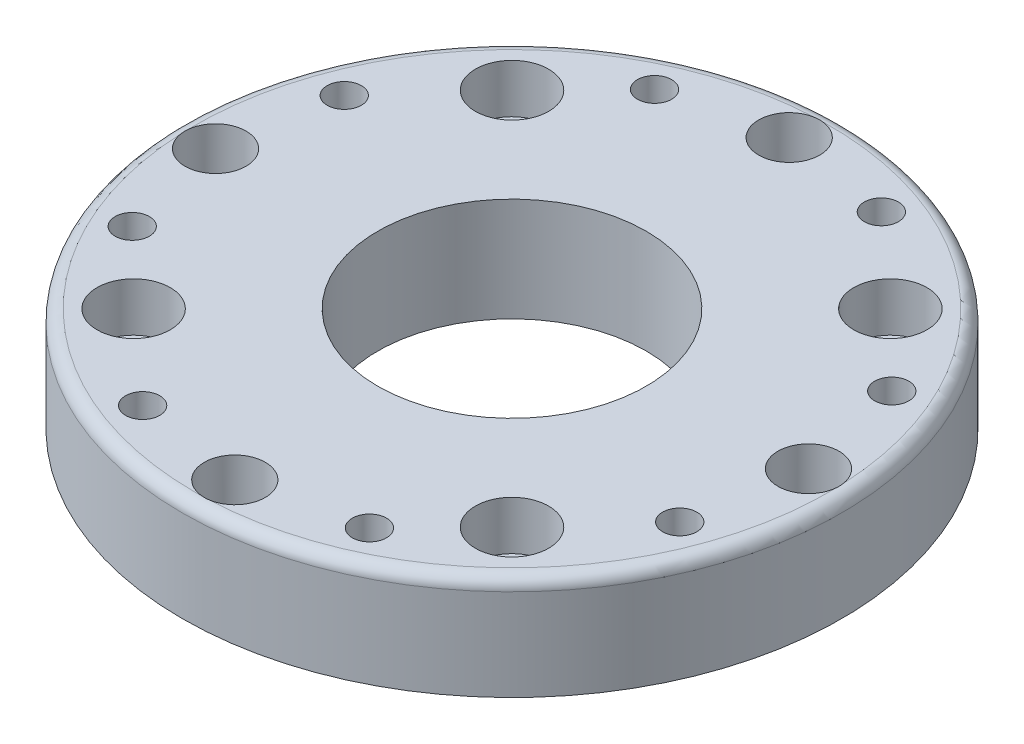
from build123d import *

# Parameters (mm, degrees)
SKETCH2_R                      = 27
BOSS_EXTRUDE1_DEPTH            = 8.5
SKETCH3_R                      = 1.6
NEMA_MOUNTS_HOLES_M3_DEPTH     = 8.5
SKETCH3_4_R                    = 3
NEMA_MOUNT_HOLES_CAP_6MM_DEPTH = 4
SKETCH5_R                      = 1.4
REDUCER_HOLES_M2_5_DEPTH       = 8.5
REDUCER_NUTS_M2_5_DEPTH        = 4
SKETCH9_R                      = 11
SHAFT_SKIRT_22MM_DEPTH         = 8.5
FILLET1_R                      = 1
CUT_EXTRUDE1_START             = -8.5
SKETCH10_R                     = 2.5
CUT_EXTRUDE1_DEPTH             = 5
FILLET3_R                      = 1


with BuildPart() as part:
    # Sketch2 → Boss-Extrude1 (new body)
    with BuildSketch(Plane(origin=(0, 693.868908512, 0), x_dir=(-1, 0, 0), z_dir=(0, 1, 0))):
        with Locations(Location((-1181.798443484, 915.067639521, 0), (0, 0, 90))):
            Circle(SKETCH2_R)
    extrude(amount=BOSS_EXTRUDE1_DEPTH)

    # Sketch3 → Nema_Mounts_holes_M3 (cut)
    with BuildSketch(Plane(origin=(0, 702.368908512, 0), x_dir=(-1, 0, 0), z_dir=(0, 1, 0))):
        with Locations(Location((-1197.298443484, 930.567639521, 0), (0, 0, 90))):
            Circle(SKETCH3_R)
        with Locations(Location((-1166.298443484, 930.567639521, 0), (0, 0, 90))):
            Circle(SKETCH3_R)
        with Locations(Location((-1197.298443484, 899.567639521, 0), (0, 0, 90))):
            Circle(SKETCH3_R)
        with Locations(Location((-1166.298443484, 899.567639521, 0), (0, 0, 90))):
            Circle(SKETCH3_R)
    extrude(amount=-NEMA_MOUNTS_HOLES_M3_DEPTH, mode=Mode.SUBTRACT)

    # Sketch3<4> → Nema_Mount_holes_cap_6mm (cut)
    with BuildSketch(Plane(origin=(0, 702.368908512, 0), x_dir=(-1, 0, 0), z_dir=(0, 1, 0))):
        with Locations(Location((-1197.298443484, 930.567639521, 0), (0, 0, 90))):
            Circle(SKETCH3_4_R)
        with Locations(Location((-1166.298443484, 930.567639521, 0), (0, 0, 90))):
            Circle(SKETCH3_4_R)
        with Locations(Location((-1197.298443484, 899.567639521, 0), (0, 0, 90))):
            Circle(SKETCH3_4_R)
        with Locations(Location((-1166.298443484, 899.567639521, 0), (0, 0, 90))):
            Circle(SKETCH3_4_R)
    extrude(amount=-NEMA_MOUNT_HOLES_CAP_6MM_DEPTH, mode=Mode.SUBTRACT)

    # Sketch5 → Reducer_Holes_M2.5 (cut)
    with BuildSketch(Plane(origin=(0, 702.368908512, 0), x_dir=(-1, 0, 0), z_dir=(0, 1, 0))):
        with Locations(Location((-1160.401515615, 924.78471098, 0), (0, 0, 90))):
            Circle(SKETCH5_R)
        with Locations(Location((-1159.797523569, 906.80873385, 0), (0, 0, 90))):
            Circle(SKETCH5_R)
        with Locations(Location((-1172.081372025, 893.670711651, 0), (0, 0, 90))):
            Circle(SKETCH5_R)
        with Locations(Location((-1190.057349155, 893.066719605, 0), (0, 0, 90))):
            Circle(SKETCH5_R)
        with Locations(Location((-1203.195371354, 905.350568061, 0), (0, 0, 90))):
            Circle(SKETCH5_R)
        with Locations(Location((-1203.7993634, 923.326545192, 0), (0, 0, 90))):
            Circle(SKETCH5_R)
        with Locations(Location((-1191.515514944, 936.46456739, 0), (0, 0, 90))):
            Circle(SKETCH5_R)
        with Locations(Location((-1173.539537814, 937.068559436, 0), (0, 0, 90))):
            Circle(SKETCH5_R)
    extrude(amount=-REDUCER_HOLES_M2_5_DEPTH, mode=Mode.SUBTRACT)

    # Sketch6 → Reducer_Nuts_M2.5 (cut)
    with BuildSketch(Plane.XZ.offset(-693.868908512)):
        Polygon((1176.236307168, 938.098495541), (1173.99597166, 939.918998258), (1171.299202305, 938.889062153), (1170.842768459, 936.038623331), (1173.083103967, 934.218120614), (1175.779873322, 935.248056719), align=None)
        Polygon((1162.094332768, 922.446398892), (1163.272961862, 925.081577594), (1161.580144709, 927.419889682), (1158.708698462, 927.123023068), (1157.530069368, 924.487844366), (1159.222886521, 922.149532278), align=None)
        Polygon((1194.150693646, 935.285938296), (1193.853827032, 938.157384543), (1191.21864833, 939.336013637), (1188.880336242, 937.643196484), (1189.177202856, 934.771750238), (1191.812381558, 933.593121144), align=None)
        Polygon((1204.829299505, 920.629775837), (1206.649802222, 922.870111345), (1205.619866117, 925.5668807), (1202.769427295, 926.023314546), (1200.948924578, 923.782979038), (1201.978860683, 921.086209683), align=None)
        Polygon((1202.01674226, 902.715389359), (1204.888188506, 903.012255973), (1206.0668176, 905.647434675), (1204.374000448, 907.985746763), (1201.502554201, 907.688880149), (1200.323925107, 905.053701447), align=None)
        Polygon((1187.3605798, 892.0367835), (1189.600915309, 890.216280784), (1192.297684664, 891.246216889), (1192.75411851, 894.096655711), (1190.513783001, 895.917158427), (1187.817013647, 894.887222322), align=None)
        Polygon((1169.446193323, 894.849340745), (1169.743059937, 891.977894499), (1172.378238639, 890.799265405), (1174.716550727, 892.492082557), (1174.419684113, 895.363528804), (1171.784505411, 896.542157898), align=None)
        Polygon((1158.767587464, 909.505503205), (1156.947084747, 907.265167696), (1157.977020852, 904.568398341), (1160.827459674, 904.111964495), (1162.647962391, 906.352300004), (1161.618026286, 909.049069359), align=None)
    extrude(amount=-REDUCER_NUTS_M2_5_DEPTH, mode=Mode.SUBTRACT)

    # Sketch9 → Shaft_skirt_22mm (cut)
    with BuildSketch(Plane(origin=(0, 693.868908512, 0), x_dir=(-1, 0, 0), z_dir=(0, -1, 0))):
        with Locations(Location((-1181.798443484, -915.067639521, 0), (0, 0, 90))):
            Circle(SKETCH9_R)
    extrude(amount=-SHAFT_SKIRT_22MM_DEPTH, mode=Mode.SUBTRACT)

    # Fillet1
    fillet1_edges = [part.edges().sort_by_distance(p)[0] for p in [
        (1181.798443484, 702.368908512, 888.067639521),
    ]]
    fillet(fillet1_edges, radius=FILLET1_R)

    # Sketch10 → Cut-Extrude1 (cut)
    with BuildSketch(Plane.XZ.offset(-693.868908512).offset(CUT_EXTRUDE1_START)):
        with Locations(Location((1182.58828203, 938.567639521, 0), (0, 0, 90))):
            Circle(SKETCH10_R)
        with Locations(Location((1205.298443484, 914.277800975, 0), (0, 0, 90))):
            Circle(SKETCH10_R)
        with Locations(Location((1181.008604939, 891.567639521, 0), (0, 0, 90))):
            Circle(SKETCH10_R)
        with Locations(Location((1158.298443484, 915.857478067, 0), (0, 0, 90))):
            Circle(SKETCH10_R)
    extrude(amount=CUT_EXTRUDE1_DEPTH, mode=Mode.SUBTRACT)

    # Fillet3
    fillet3_edges = [part.edges().sort_by_distance(p)[0] for p in [
        (1182.58828203, 697.368908512, 936.067639521),
        (1205.298443484, 697.368908512, 911.777800975),
        (1181.008604939, 697.368908512, 889.067639521),
        (1158.298443484, 697.368908512, 913.357478067),
    ]]
    fillet(fillet3_edges, radius=FILLET3_R)


solid = part.part
